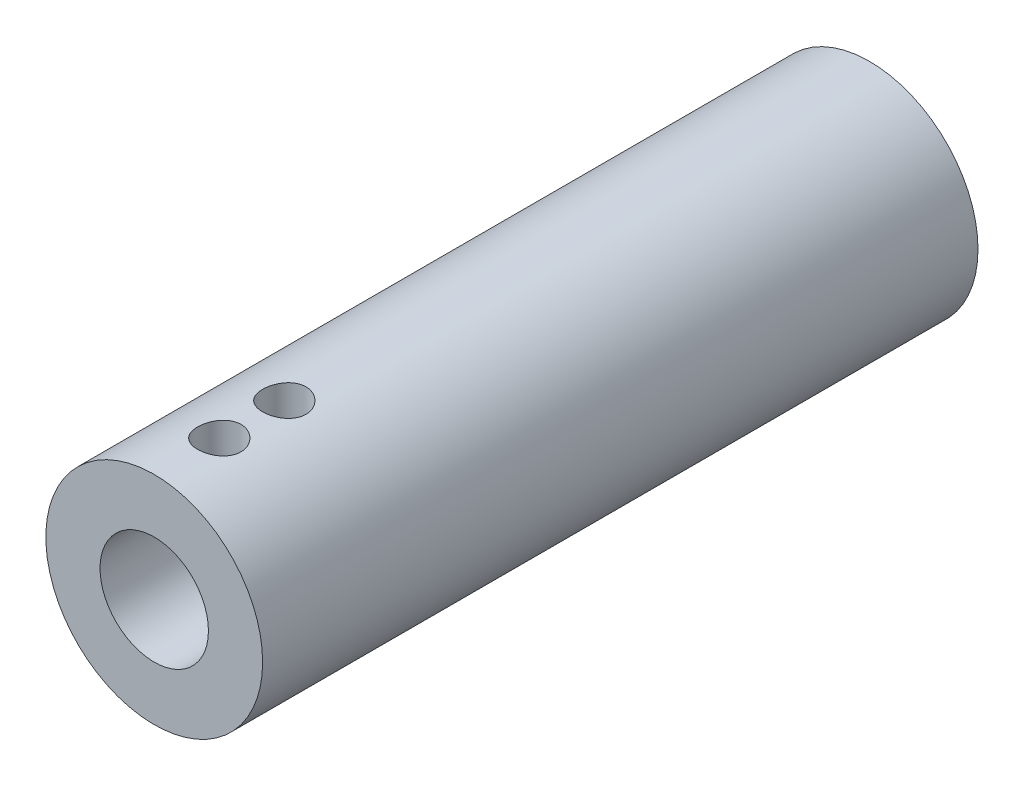
from build123d import *

# Parameters (mm, degrees)
SKETCH1_R           = 5
BOSS_EXTRUDE1_DEPTH = 33
SKETCH2_R           = 2.5
CUT_EXTRUDE1_DEPTH  = 15
SKETCH3_R           = 1.5
CUT_EXTRUDE2_DEPTH  = 10
SKETCH4_R           = 1
CUT_EXTRUDE3_DEPTH  = 10


with BuildPart() as part:
    # Sketch1 → Boss-Extrude1 (new body)
    with BuildSketch(Plane.XY):
        Circle(SKETCH1_R)
    extrude(amount=BOSS_EXTRUDE1_DEPTH)

    # Sketch2 → Cut-Extrude1 (cut)
    with BuildSketch(Plane.XY.offset(33)):
        Circle(SKETCH2_R)
    extrude(amount=-CUT_EXTRUDE1_DEPTH, mode=Mode.SUBTRACT)

    # Sketch3 → Cut-Extrude2 (cut)
    with BuildSketch(Plane(origin=(0, 0, 0), x_dir=(-1, 0, 0), z_dir=(0, 0, -1))):
        Circle(SKETCH3_R)
    extrude(amount=-CUT_EXTRUDE2_DEPTH, mode=Mode.SUBTRACT)

    # Sketch4 → Cut-Extrude3 (cut)
    with BuildSketch(Plane(origin=(0, 0, 0), x_dir=(1, 0, 0), z_dir=(0, 1, 0))):
        with Locations(Location((0, -30, 0), (0, 0, 90))):
            Circle(SKETCH4_R)
        with Locations(Location((0, -27, 0), (0, 0, 90))):
            Circle(SKETCH4_R)
    extrude(amount=CUT_EXTRUDE3_DEPTH, mode=Mode.SUBTRACT)


solid = part.part
